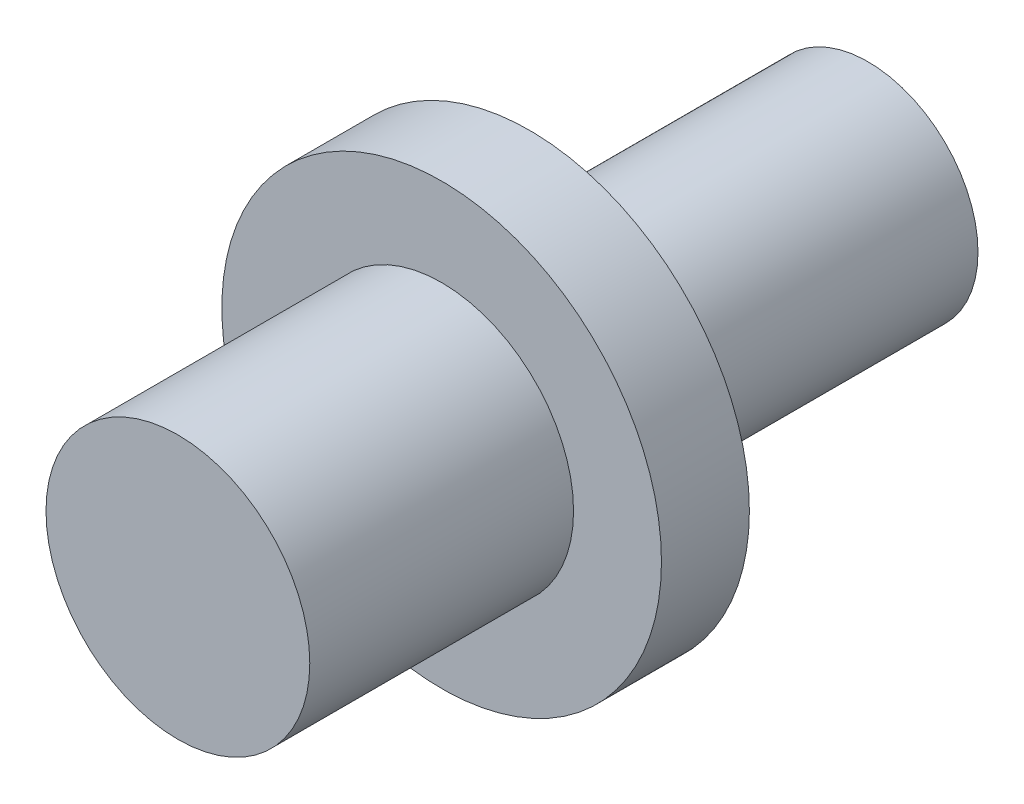
from build123d import *


with BuildPart() as part:
    # Schizzo2 → Rivoluzione1 (revolve)
    with BuildSketch(Plane(origin=(0, 0, 0), x_dir=(0, 0, -1), z_dir=(1, 0, 0)), mode=Mode.PRIVATE) as rivoluzione1_sk:
        Polygon((0, 0), (0, 3), (6, 3), (6, 5), (8, 5), (8, 2.5), (13, 2.5), (15.7, 2.5), (15.7, 0), align=None)
    revolve(rivoluzione1_sk.sketch.rotate(Axis((0, 0, 0), (0, 0, -1)), 90), axis=Axis((0, 0, 0), (0, 0, -1)))


solid = part.part
